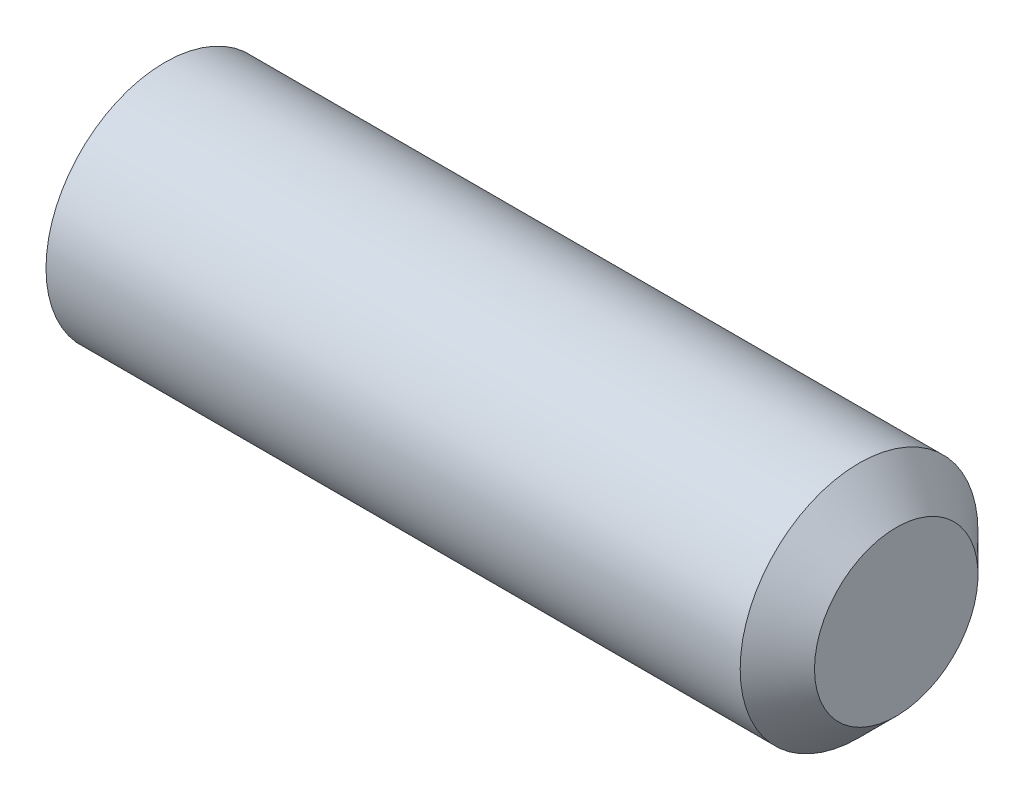
from build123d import *

# Parameters (mm, degrees)
HEX_2_DEPTH = 4


with BuildPart() as part:
    # BodySke → BaseBody (revolve)
    with BuildSketch(Plane.XY, mode=Mode.PRIVATE) as basebody_sk:
        Polygon((0, 0), (0, 3.3095), (0.398660361, 4), (23.75, 4), (25, 2.75), (25, 0), align=None)
    revolve(basebody_sk.sketch.rotate(Axis((-12.7, 0, 0), (1, 0, 0)), 90), axis=Axis((-12.7, 0, 0), (1, 0, 0)))

    # Sketch2 → Hex 2 (cut)
    with BuildSketch(Plane.ZY):
        Polygon((1.154700538, 2), (-1.154700538, 2), (-2.309401077, 0), (-1.154700538, -2), (1.154700538, -2), (2.309401077, 0), align=None)
    extrude(amount=-HEX_2_DEPTH, mode=Mode.SUBTRACT)


solid = part.part
